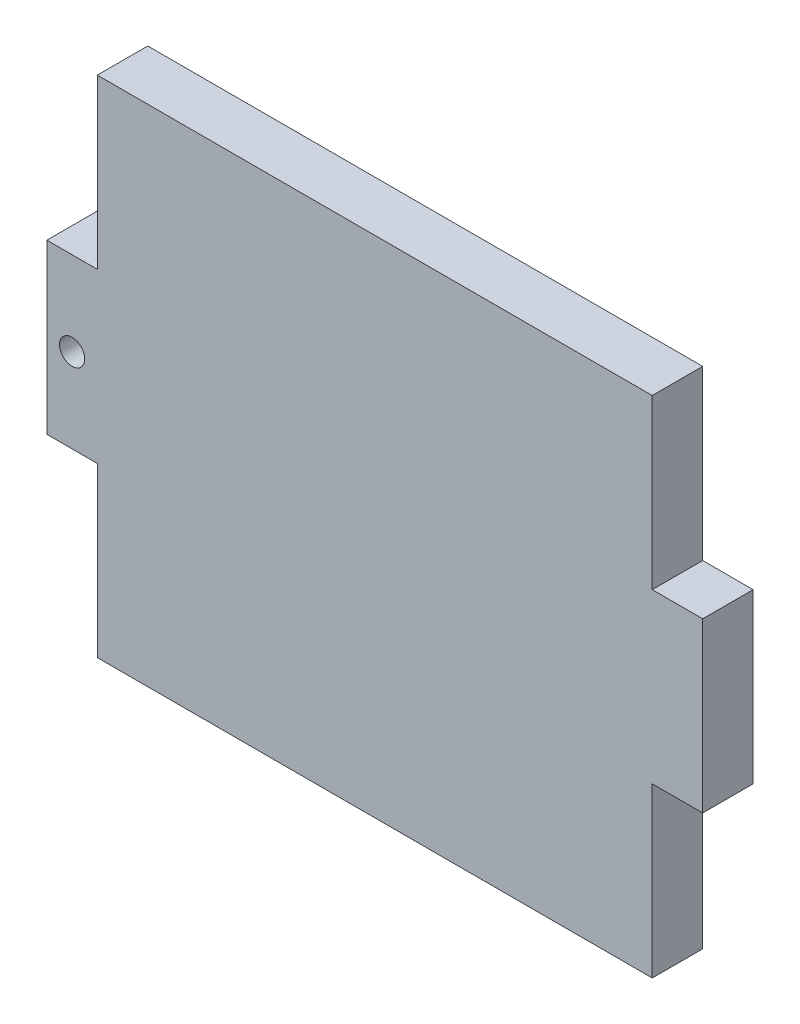
from build123d import *

# Parameters (mm, degrees)
ESQUISSE1_R        = 1.5
BOSS_EXTRU_1_DEPTH = 6


with BuildPart() as part:
    # Esquisse1 → Boss.-Extru.1 (new body)
    with BuildSketch(Plane.XY):
        Polygon((0, 0), (-66, 0), (-66, 20), (-72, 20), (-72, 40), (-66, 40), (-66, 60), (0, 60), (0, 40), (6, 40), (6, 20), (0, 20), align=None)
        with Locations((-69, 30)):
            Circle(ESQUISSE1_R, mode=Mode.SUBTRACT)
    extrude(amount=BOSS_EXTRU_1_DEPTH)


solid = part.part
